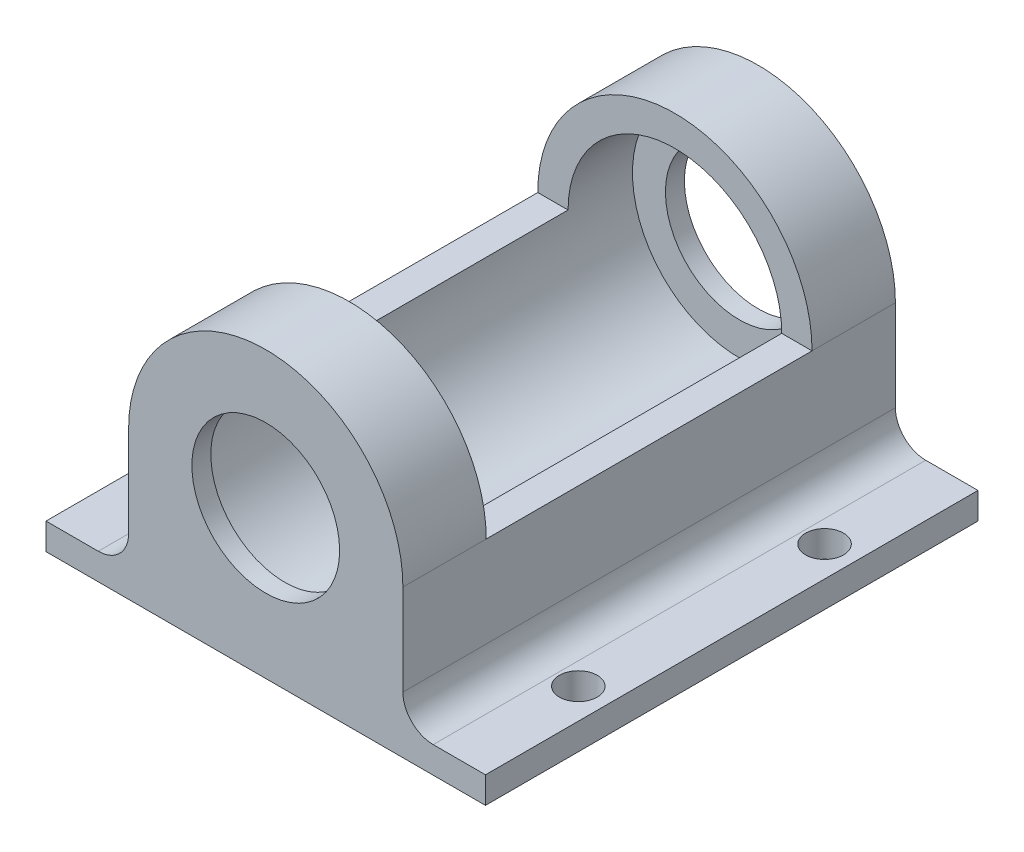
from build123d import *

# Parameters (mm, degrees)
SKETCH1_W           = 58
SKETCH1_H           = 65
SKETCH1_R           = 2.5
BOSS_EXTRUDE1_DEPTH = 3.5
SKETCH2_R           = 14.1
SKETCH2_R_2         = 9.75
BOSS_EXTRUDE2_DEPTH = 2.5
SKETCH2_3_R         = 14.1
BOSS_EXTRUDE3_DEPTH = 11
BOSS_EXTRUDE4_START = -54
SKETCH2_4_R         = 14.1
BOSS_EXTRUDE4_DEPTH = 11
BOSS_EXTRUDE5_START = -62.5
SKETCH2_5_R         = 14.1
SKETCH2_5_R_2       = 9.75
BOSS_EXTRUDE5_DEPTH = 2.5
FILLET3_R           = 4
BOSS_EXTRUDE6_REACH = 73.908


with BuildPart() as part:
    # Sketch1 → Boss-Extrude1 (new body)
    with BuildSketch(Plane(origin=(0, 0, 0), x_dir=(1, 0, 0), z_dir=(0, 1, 0))):
        Rectangle(SKETCH1_W, SKETCH1_H)
        with Locations(Location((-25, -16.25, 0), (0, 0, 270))):
            Circle(SKETCH1_R, mode=Mode.SUBTRACT)
        with Locations(Location((25, -16.25, 0), (0, 0, 270))):
            Circle(SKETCH1_R, mode=Mode.SUBTRACT)
        with Locations(Location((25, 16.25, 0), (0, 0, 270))):
            Circle(SKETCH1_R, mode=Mode.SUBTRACT)
        with Locations(Location((-25, 16.25, 0), (0, 0, 270))):
            Circle(SKETCH1_R, mode=Mode.SUBTRACT)
    extrude(amount=BOSS_EXTRUDE1_DEPTH)

    # Sketch2 → Boss-Extrude2 (add)
    # profile 1 of 2: a face of its own
    with BuildSketch(Plane.XY.offset(32.5)):
        with BuildLine():
            ThreePointArc((18.1, 19.5), (0, 37.6), (-18.1, 19.5))
            Line((-18.1, 19.5), (-18.1, 3.5))
            Line((-18.1, 3.5), (18.1, 3.5))
            Line((18.1, 3.5), (18.1, 19.5))
        make_face()
        with Locations((0, 19.5)):
            Circle(SKETCH2_R, mode=Mode.SUBTRACT)
    # profile 2 of 2: a face of its own
    with BuildSketch(Plane.XY.offset(32.5)):
        with Locations((0, 19.5)):
            Circle(SKETCH2_R)
        with Locations((0, 19.5)):
            Circle(SKETCH2_R_2, mode=Mode.SUBTRACT)
    extrude(amount=-BOSS_EXTRUDE2_DEPTH)

    # Sketch2<3> → Boss-Extrude3 (add)
    with BuildSketch(Plane.XY.offset(32.5)):
        with BuildLine():
            ThreePointArc((18.1, 19.5), (0, 37.6), (-18.1, 19.5))
            Line((-18.1, 19.5), (-18.1, 3.5))
            Line((-18.1, 3.5), (18.1, 3.5))
            Line((18.1, 3.5), (18.1, 19.5))
        make_face()
        with Locations((0, 19.5)):
            Circle(SKETCH2_3_R, mode=Mode.SUBTRACT)
    extrude(amount=-BOSS_EXTRUDE3_DEPTH)

    # Sketch2<4> → Boss-Extrude4 (add)
    with BuildSketch(Plane.XY.offset(32.5).offset(BOSS_EXTRUDE4_START)):
        with BuildLine():
            ThreePointArc((18.1, 19.5), (0, 37.6), (-18.1, 19.5))
            Line((-18.1, 19.5), (-18.1, 3.5))
            Line((-18.1, 3.5), (-29, 3.5))
            Line((-29, 3.5), (-29, 0))
            Line((-29, 0), (29, 0))
            Line((29, 0), (29, 3.5))
            Line((29, 3.5), (18.1, 3.5))
            Line((18.1, 3.5), (18.1, 19.5))
        make_face()
        with Locations((0, 19.5)):
            Circle(SKETCH2_4_R, mode=Mode.SUBTRACT)
    extrude(amount=-BOSS_EXTRUDE4_DEPTH)

    # Sketch2<5> → Boss-Extrude5 (add)
    with BuildSketch(Plane.XY.offset(32.5).offset(BOSS_EXTRUDE5_START)):
        with Locations((0, 19.5)):
            Circle(SKETCH2_5_R)
        with Locations((0, 19.5)):
            Circle(SKETCH2_5_R_2, mode=Mode.SUBTRACT)
    extrude(amount=-BOSS_EXTRUDE5_DEPTH)

    # Fillet3
    fillet3_edges = [part.edges().sort_by_distance(p)[0] for p in [
        (18.1, 3.5, 27),
        (-18.1, 3.5, 27),
        (-18.1, 3.5, -27),
        (18.1, 3.5, -27),
    ]]
    fillet(fillet3_edges, radius=FILLET3_R)

    # Sketch6 → Boss-Extrude6 (add, up to next)
    with BuildSketch(Plane.XY.offset(-21.5), mode=Mode.PRIVATE) as boss_extrude6_sk1:
        with BuildLine():
            Line((-18.1, 7.5), (-18.1, 19.5))
            Line((-18.1, 19.5), (-14.1, 19.5))
            ThreePointArc((-14.1, 19.5), (0, 5.4), (14.1, 19.5))
            Line((14.1, 19.5), (18.1, 19.5))
            Line((18.1, 19.5), (18.1, 7.5))
            ThreePointArc((18.1, 7.5), (19.271572875, 4.671572875), (22.1, 3.5))
            Line((22.1, 3.5), (-22.1, 3.5))
            ThreePointArc((-22.1, 3.5), (-19.271572875, 4.671572875), (-18.1, 7.5))
        make_face()
    boss_extrude6_tool1 = extrude(boss_extrude6_sk1.sketch, amount=BOSS_EXTRUDE6_REACH, mode=Mode.PRIVATE) - part.part
    add(boss_extrude6_tool1.solids().sort_by_distance((-18.939185, 4.339185, -21.5))[0])


solid = part.part
